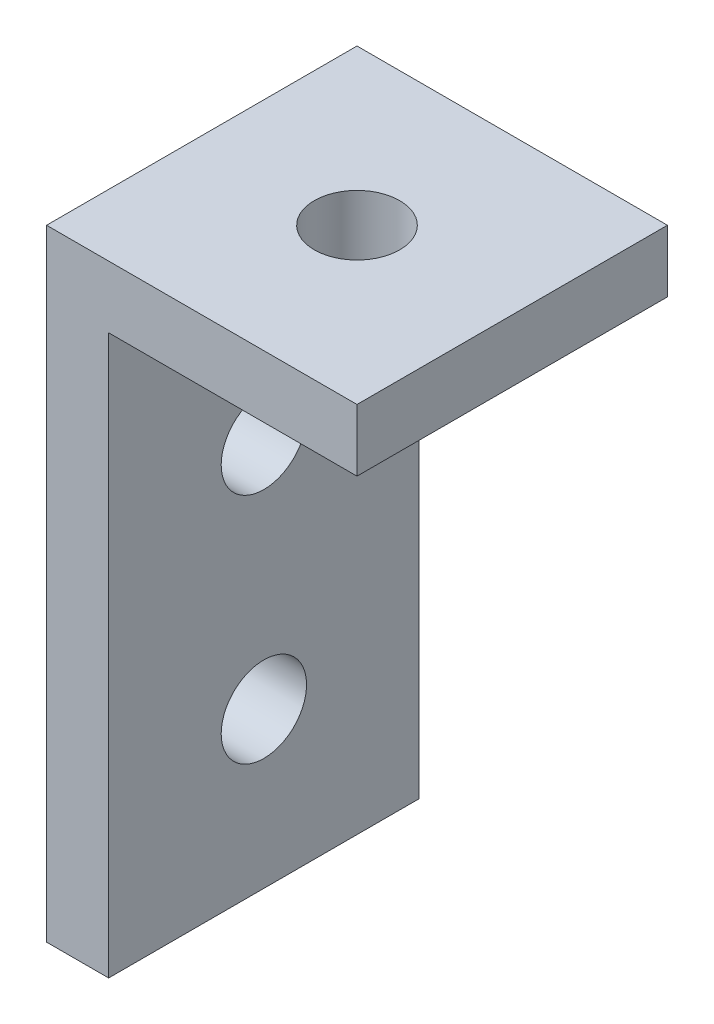
from build123d import *

# Parameters (mm, degrees)
BOSS_EXTRUDE1_DEPTH = 20
SKETCH2_R           = 2.75
CUT_EXTRUDE1_DEPTH  = 49.989794856
SKETCH3_R           = 2.75
CUT_EXTRUDE2_DEPTH  = 49.989794856


with BuildPart() as part:
    # Sketch1 → Boss-Extrude1 (new body)
    with BuildSketch(Plane.XY):
        Polygon((0, 0), (4, 0), (4, 36), (20, 36), (20, 40), (0, 40), align=None)
    extrude(amount=BOSS_EXTRUDE1_DEPTH)

    # Sketch2 → Cut-Extrude1 (cut, through all)
    with BuildSketch(Plane(origin=(0, 40, 0), x_dir=(1, 0, 0), z_dir=(0, 1, 0))):
        with Locations(Location((10, -10, 0), (0, 0, 270))):
            Circle(SKETCH2_R)
    extrude(amount=-CUT_EXTRUDE1_DEPTH, mode=Mode.SUBTRACT)

    # Sketch3 → Cut-Extrude2 (cut, through all)
    with BuildSketch(Plane.ZY):
        with Locations((10, 10)):
            Circle(SKETCH3_R)
        with Locations((10, 25)):
            Circle(SKETCH3_R)
    extrude(amount=-CUT_EXTRUDE2_DEPTH, mode=Mode.SUBTRACT)


solid = part.part
